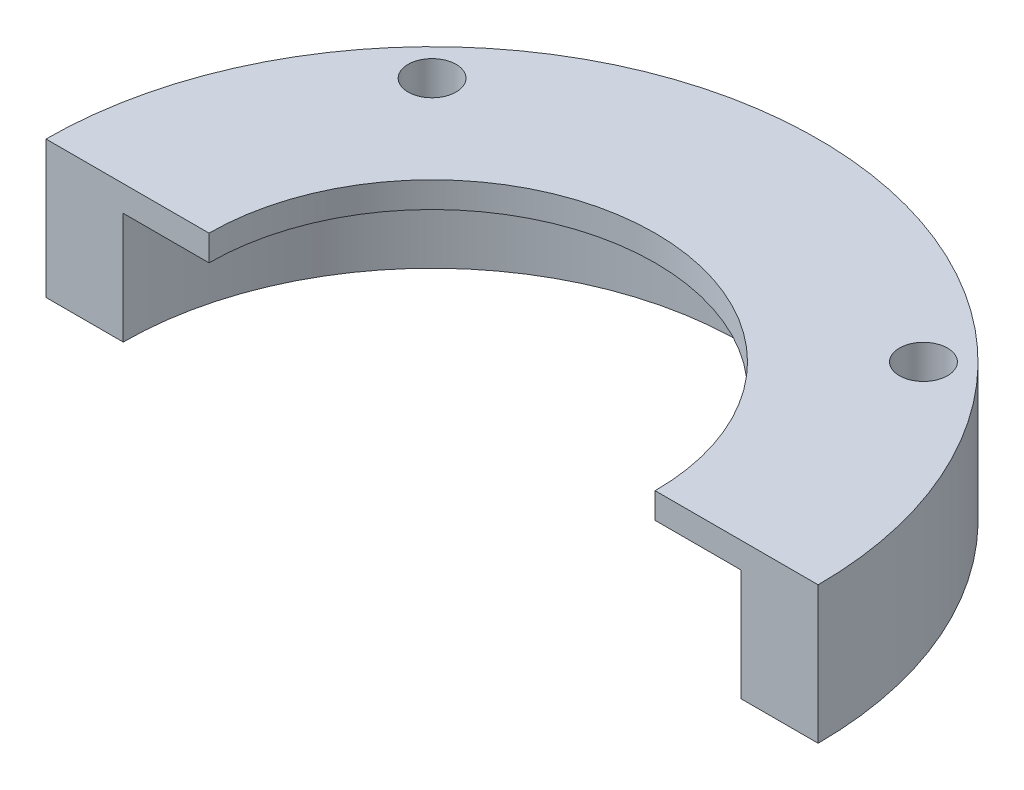
from build123d import *

# Parameters (mm, degrees)
SKETCH1_R           = 28.575
BOSS_EXTRUDE1_DEPTH = 10.16
SKETCH2_R           = 16.51
CUT_EXTRUDE1_DEPTH  = 42.66877548
SKETCH3_R           = 22.86
CUT_EXTRUDE2_DEPTH  = 8.255
SKETCH4_W           = 88.915115744
SKETCH4_H           = 51.352535237
CUT_EXTRUDE3_DEPTH  = 42.66877548
CUT_EXTRUDE4_REACH  = 43.669
SKETCH6_R           = 1.778


with BuildPart() as part:
    # Sketch1 → Boss-Extrude1 (new body)
    with BuildSketch(Plane(origin=(0, 0, 0), x_dir=(1, 0, 0), z_dir=(0, 1, 0))):
        with Locations(Location((0, 0, 0), (0, 0, 270))):
            Circle(SKETCH1_R)
    extrude(amount=BOSS_EXTRUDE1_DEPTH)

    # Sketch2 → Cut-Extrude1 (cut, through all)
    with BuildSketch(Plane.XZ):
        with Locations(Location((0, 0, 0), (0, 0, 270))):
            Circle(SKETCH2_R)
    extrude(amount=-CUT_EXTRUDE1_DEPTH, mode=Mode.SUBTRACT)

    # Sketch3 → Cut-Extrude2 (cut)
    with BuildSketch(Plane.XZ):
        with Locations(Location((0, 0, 0), (0, 0, 270))):
            Circle(SKETCH3_R)
    extrude(amount=-CUT_EXTRUDE2_DEPTH, mode=Mode.SUBTRACT)

    # Sketch4 → Cut-Extrude3 (cut, through all)
    with BuildSketch(Plane(origin=(0, 10.16, 0), x_dir=(1, 0, 0), z_dir=(0, 1, 0))):
        with Locations((4.883047594, -25.676267619)):
            Rectangle(SKETCH4_W, SKETCH4_H)
    extrude(amount=-CUT_EXTRUDE3_DEPTH, mode=Mode.SUBTRACT)

    # Sketch6 → Cut-Extrude4 (cut, up to next)
    with BuildSketch(Plane.XZ, mode=Mode.PRIVATE) as cut_extrude4_sk1:
        with Locations(Location((18.185018645, -18.185018645, 0), (0, 0, 270))):
            Circle(SKETCH6_R)
    cut_extrude4_tool1 = extrude(cut_extrude4_sk1.sketch, amount=-CUT_EXTRUDE4_REACH, mode=Mode.PRIVATE) & part.part
    # Sketch6 → Cut-Extrude4 (cut, up to next)
    with BuildSketch(Plane.XZ, mode=Mode.PRIVATE) as cut_extrude4_sk2:
        with Locations(Location((-18.185018645, -18.185018645, 0), (0, 0, 270))):
            Circle(SKETCH6_R)
    cut_extrude4_tool2 = extrude(cut_extrude4_sk2.sketch, amount=-CUT_EXTRUDE4_REACH, mode=Mode.PRIVATE) & part.part
    add(cut_extrude4_tool1.solids().sort_by_distance((18.185019, 0, -18.185019))[0], mode=Mode.SUBTRACT)
    add(cut_extrude4_tool2.solids().sort_by_distance((-18.185019, 0, -18.185019))[0], mode=Mode.SUBTRACT)


solid = part.part
